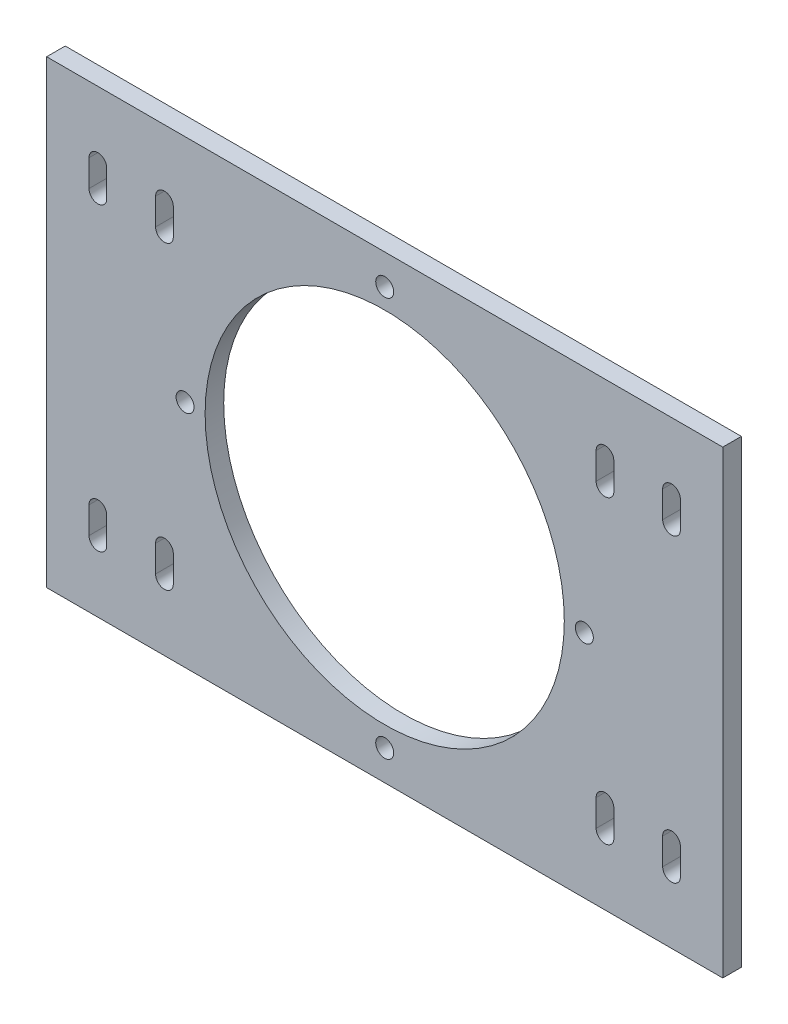
from build123d import *

# Parameters (mm, degrees)
SKETCH1_W                                = 152.4
SKETCH1_H                                = 138.176
SKETCH1_R                                = 53.975
BOSS_EXTRUDE1_DEPTH                      = 5.588
SKETCH5_R                                = 2.665
CUT_EXTRUDE4_DEPTH                       = 450.319819698
CUT_EXTRUDE5_DEPTH                       = 104.008822379
MIRROR1_AT_THE_SECOND_PLANE_COPY_1_DEPTH = 104.008822379
SKETCH7_W                                = 5.588
SKETCH7_H                                = 138.176
BOSS_EXTRUDE2_DEPTH                      = 25.4
CUT_EXTRUDE6_DEPTH                       = 123.991615519
MIRROR3_COPY_1_DEPTH                     = 123.991615519
SKETCH9_R                                = 2.7
CUT_EXTRUDE7_DEPTH                       = 483.750396617


with BuildPart() as part:
    # Sketch1 → Boss-Extrude1 (new body)
    with BuildSketch(Plane.XY):
        Rectangle(SKETCH1_W, SKETCH1_H)
        Circle(SKETCH1_R, mode=Mode.SUBTRACT)
    extrude(amount=BOSS_EXTRUDE1_DEPTH)

    # Sketch5 → Cut-Extrude4 (cut, through all)
    with BuildSketch(Plane(origin=(-338.200209725, -104.490630048, 5.588), x_dir=(0.9999190535665993, -0.012723455288419956, 0), z_dir=(0, 0, 1))):
        with Locations(Location((403.626134832, 63.40628164, 0), (0, 0, 0.729019959))):
            Circle(SKETCH5_R)
    extrude(amount=-CUT_EXTRUDE4_DEPTH, mode=Mode.SUBTRACT)

    # Sketch6 → Cut-Extrude5 (cut, through all)
    with BuildSketch(Plane(origin=(0, 0, 0), x_dir=(-1, 0, 0), z_dir=(0, 0, -1))):
        with BuildLine():
            Line((-68.865, -49.163584611), (-68.865, -41.163584611))
            ThreePointArc((-68.865, -41.163584611), (-66.2, -38.498584611), (-63.535, -41.163584611))
            Line((-63.535, -41.163584611), (-63.535, -49.163584611))
            ThreePointArc((-63.535, -49.163584611), (-66.2, -51.828584611), (-68.865, -49.163584611))
        make_face()
    cut_extrude5 = extrude(amount=-CUT_EXTRUDE5_DEPTH, mode=Mode.SUBTRACT)

    # Mirror1: Cut-Extrude5 across plane
    add(cut_extrude5.mirror(Plane(origin=(0, 0, 0), x_dir=(0, 0, 1), z_dir=(1, 0, 0))), mode=Mode.SUBTRACT)

    # Mirror1 at the second plane: Cut-Extrude5 across plane
    add(cut_extrude5.mirror(Plane.ZX), mode=Mode.SUBTRACT)

    # Mirror1 at the second plane copy 1 sketc → Mirror1 at the second plane copy 1 (cut, through all)
    with BuildSketch(Plane(origin=(0, 0, 0), x_dir=(1, 0, 0), z_dir=(0, 0, -1))):
        with BuildLine():
            Line((-68.865, -49.163584611), (-68.865, -41.163584611))
            ThreePointArc((-68.865, -41.163584611), (-66.2, -38.498584611), (-63.535, -41.163584611))
            Line((-63.535, -41.163584611), (-63.535, -49.163584611))
            ThreePointArc((-63.535, -49.163584611), (-66.2, -51.828584611), (-68.865, -49.163584611))
        make_face()
    extrude(amount=-MIRROR1_AT_THE_SECOND_PLANE_COPY_1_DEPTH, mode=Mode.SUBTRACT)

    # Sketch7 → Boss-Extrude2 (add)
    with BuildSketch(Plane(origin=(76.2, 0, 0), x_dir=(0, 0, -1), z_dir=(1, 0, 0))):
        with Locations((-2.794, 0)):
            Rectangle(SKETCH7_W, SKETCH7_H)
    boss_extrude2 = extrude(amount=BOSS_EXTRUDE2_DEPTH)

    # Sketch8 → Cut-Extrude6 (cut, through all)
    with BuildSketch(Plane(origin=(0, 0, 0), x_dir=(-1, 0, 0), z_dir=(0, 0, -1))):
        with BuildLine():
            Line((-63.535, 49.163584611), (-63.535, 41.163584611))
            ThreePointArc((-63.535, 41.163584611), (-66.2, 38.498584611), (-68.865, 41.163584611))
            Line((-68.865, 41.163584611), (-68.865, 49.163584611))
            ThreePointArc((-68.865, 49.163584611), (-66.2, 51.828584611), (-63.535, 49.163584611))
        make_face()
        with BuildLine():
            Line((-83.535, 41.163584611), (-83.535, 49.163584611))
            ThreePointArc((-83.535, 49.163584611), (-86.2, 51.828584611), (-88.865, 49.163584611))
            Line((-88.865, 49.163584611), (-88.865, 41.163584611))
            ThreePointArc((-88.865, 41.163584611), (-86.2, 38.498584611), (-83.535, 41.163584611))
        make_face()
    cut_extrude6 = extrude(amount=-CUT_EXTRUDE6_DEPTH, mode=Mode.SUBTRACT)

    # Mirror2: Cut-Extrude6 across plane
    add(cut_extrude6.mirror(Plane.ZX), mode=Mode.SUBTRACT)

    # Mirror3: Boss-Extrude2, Cut-Extrude6 across plane
    add(boss_extrude2.mirror(Plane(origin=(0, 0, 0), x_dir=(0, 0, 1), z_dir=(1, 0, 0))))
    add(cut_extrude6.mirror(Plane(origin=(0, 0, 0), x_dir=(0, 0, 1), z_dir=(1, 0, 0))), mode=Mode.SUBTRACT)

    # Mirror3 copy 1 sketch → Mirror3 copy 1 (cut, through all)
    with BuildSketch(Plane(origin=(0, 0, 0), x_dir=(1, 0, 0), z_dir=(0, 0, -1))):
        with BuildLine():
            Line((-63.535, 49.163584611), (-63.535, 41.163584611))
            ThreePointArc((-63.535, 41.163584611), (-66.2, 38.498584611), (-68.865, 41.163584611))
            Line((-68.865, 41.163584611), (-68.865, 49.163584611))
            ThreePointArc((-68.865, 49.163584611), (-66.2, 51.828584611), (-63.535, 49.163584611))
        make_face()
        with BuildLine():
            Line((-83.535, 41.163584611), (-83.535, 49.163584611))
            ThreePointArc((-83.535, 49.163584611), (-86.2, 51.828584611), (-88.865, 49.163584611))
            Line((-88.865, 49.163584611), (-88.865, 41.163584611))
            ThreePointArc((-88.865, 41.163584611), (-86.2, 38.498584611), (-83.535, 41.163584611))
        make_face()
    extrude(amount=-MIRROR3_COPY_1_DEPTH, mode=Mode.SUBTRACT)

    # Sketch9 → Cut-Extrude7 (cut, through all)
    with BuildSketch(Plane(origin=(-338.200209725, -129.890630048, 0), x_dir=(-0.9999190535665993, 0.012723455288419956, 0), z_dir=(0, 0, -1))):
        with Locations(Location((-276.525032787, 133.419783795, 0), (0, 0, 359.270980041))):
            Circle(SKETCH9_R)
        with Locations(Location((-337.283583318, 74.188047898, 0), (0, 0, 359.270980041))):
            Circle(SKETCH9_R)
        with Locations(Location((-396.515319215, 134.946598429, 0), (0, 0, 359.270980041))):
            Circle(SKETCH9_R)
        with Locations(Location((-335.756768683, 194.178334326, 0), (0, 0, 359.270980041))):
            Circle(SKETCH9_R)
    extrude(amount=-CUT_EXTRUDE7_DEPTH, mode=Mode.SUBTRACT)


solid = part.part
